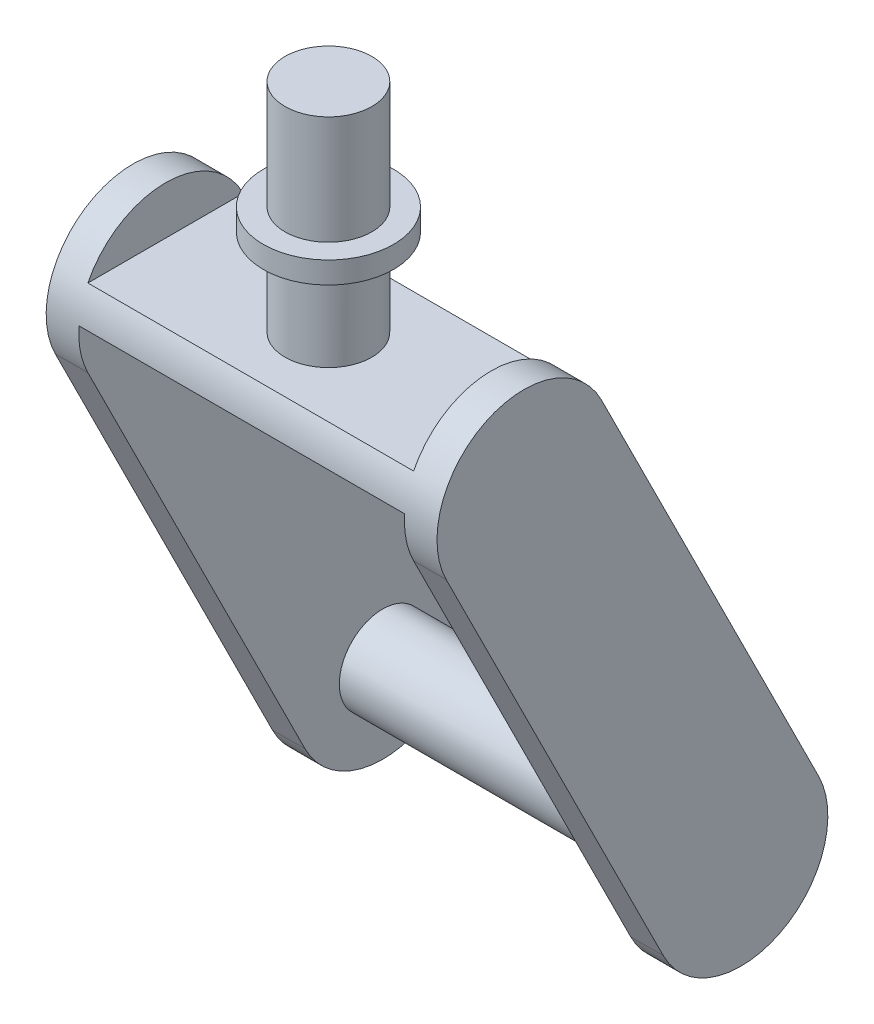
from build123d import *

# Parameters (mm, degrees)
EXTRUDE_1_DEPTH      = 15
EXTRUDE_1_DEPTH_BACK = 15
SKETCH_1_R           = 4
SKETCH_2_R           = 8
SKETCH_2_R_2         = 4
EXTRUDE_3_DEPTH      = 3
EXTRUDE_4_DEPTH      = 30
SKETCH_4_R           = 4
EXTRUDE_5_DEPTH      = 8
SKETCH_5_R           = 6
EXTRUDE_6_DEPTH      = 2
SKETCH_6_R           = 4
EXTRUDE_7_DEPTH      = 10


with BuildPart() as part:
    # 草图1 → 凸台-拉伸1 (new, two sides: drawn at the far end of the back side and taken through both)
    with BuildSketch(Plane(origin=(0, 0, 0), x_dir=(0, 0, -1), z_dir=(1, 0, 0)).offset(-EXTRUDE_1_DEPTH_BACK)):
        Circle(SKETCH_1_R)
    extrude(amount=EXTRUDE_1_DEPTH + EXTRUDE_1_DEPTH_BACK)

    # 草图2 → 凸台-拉伸3 (add)
    # profile 1 of 4: a face of its own
    with BuildSketch(Plane(origin=(15, 0, 0), x_dir=(0, 0, -1), z_dir=(1, 0, 0))):
        with Locations((-20, 40)):
            Circle(SKETCH_2_R)
    # profile 2 of 4: a face of its own
    with BuildSketch(Plane(origin=(15, 0, 0), x_dir=(0, 0, -1), z_dir=(1, 0, 0))):
        Circle(SKETCH_2_R)
        Circle(SKETCH_2_R_2, mode=Mode.SUBTRACT)
    # profile 3 of 4: a face of its own
    with BuildSketch(Plane(origin=(15, 0, 0), x_dir=(0, 0, -1), z_dir=(1, 0, 0))):
        Circle(SKETCH_2_R_2)
    # profile 4 of 4: a face of its own
    with BuildSketch(Plane(origin=(15, 0, 0), x_dir=(0, 0, -1), z_dir=(1, 0, 0))):
        with BuildLine():
            ThreePointArc((-12, 40), (-18.161976636, 32.214008084), (-27.155417528, 36.422291236))
            Line((-27.155417528, 36.422291236), (-7.155417528, -3.577708764))
            ThreePointArc((-7.155417528, -3.577708764), (-3.577708764, 7.155417528), (7.155417528, 3.577708764))
            Line((7.155417528, 3.577708764), (-12.844582472, 43.577708764))
            ThreePointArc((-12.844582472, 43.577708764), (-12.214008084, 41.838023364), (-12, 40))
        make_face()
    extrude_3 = extrude(amount=EXTRUDE_3_DEPTH)

    # 镜向2: 凸台-拉伸3 across plane
    add(extrude_3.mirror(Plane(origin=(0, 0, 0), x_dir=(0, 0, 1), z_dir=(1, 0, 0))))

    # 草图3 → 凸台-拉伸4 (add)
    with BuildSketch(Plane(origin=(-15, 0, 0), x_dir=(0, 0, -1), z_dir=(1, 0, 0))):
        with BuildLine():
            Line((-11.344582472, 40.577708764), (-12.844582472, 43.577708764))
            Line((-12.844582472, 43.577708764), (-27.155417528, 43.577708764))
            ThreePointArc((-27.155417528, 43.577708764), (-27.714499823, 42.118134198), (-27.979113521, 40.577708764))
            Line((-27.979113521, 40.577708764), (-11.344582472, 40.577708764))
        make_face()
    extrude(amount=EXTRUDE_4_DEPTH)

    # 草图4 → 凸台-拉伸5 (add)
    with BuildSketch(Plane(origin=(0, 43.577708764, 0), x_dir=(1, 0, 0), z_dir=(0, 1, 0))):
        with Locations(Location((0, -20, 0), (0, 0, 90))):
            Circle(SKETCH_4_R)
    extrude(amount=EXTRUDE_5_DEPTH)

    # 草图5 → 凸台-拉伸6 (add)
    with BuildSketch(Plane(origin=(0, 51.577708764, 0), x_dir=(1, 0, 0), z_dir=(0, 1, 0))):
        with Locations(Location((0, -20, 0), (0, 0, 270))):
            Circle(SKETCH_5_R)
    extrude(amount=EXTRUDE_6_DEPTH)

    # 草图6 → 凸台-拉伸7 (add)
    with BuildSketch(Plane(origin=(0, 53.577708764, 0), x_dir=(1, 0, 0), z_dir=(0, 1, 0))):
        with Locations(Location((0, -20, 0), (0, 0, 90))):
            Circle(SKETCH_6_R)
    extrude(amount=EXTRUDE_7_DEPTH)


solid = part.part
